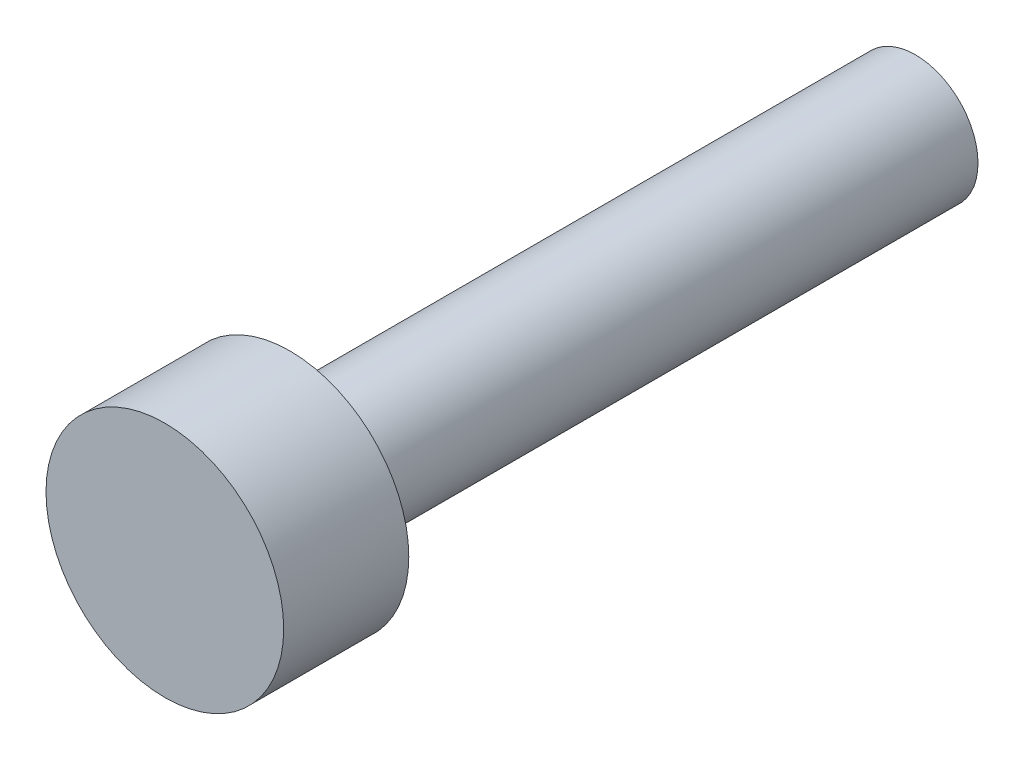
from build123d import *

# Parameters (mm, degrees)
SHANK_NOMINAL_THREAD_ENVELOPE_START     = -10
SHANK_NOMINAL_THREAD_ENVELOPE_PROFILE_R = 1
SHANK_NOMINAL_THREAD_ENVELOPE_DEPTH     = 10
SOCKET_HEAD_ENVELOPE_PROFILE_R          = 1.9
SOCKET_HEAD_ENVELOPE_DEPTH              = 2


with BuildPart() as part:
    # Shank_nominal_thread_envelope_profile → Shank_nominal_thread_envelope (new body)
    with BuildSketch(Plane.XY.offset(SHANK_NOMINAL_THREAD_ENVELOPE_START)):
        Circle(SHANK_NOMINAL_THREAD_ENVELOPE_PROFILE_R)
    extrude(amount=SHANK_NOMINAL_THREAD_ENVELOPE_DEPTH)

    # Socket_head_envelope_profile → Socket_head_envelope (add)
    with BuildSketch(Plane.XY):
        Circle(SOCKET_HEAD_ENVELOPE_PROFILE_R)
    extrude(amount=SOCKET_HEAD_ENVELOPE_DEPTH)


solid = part.part
